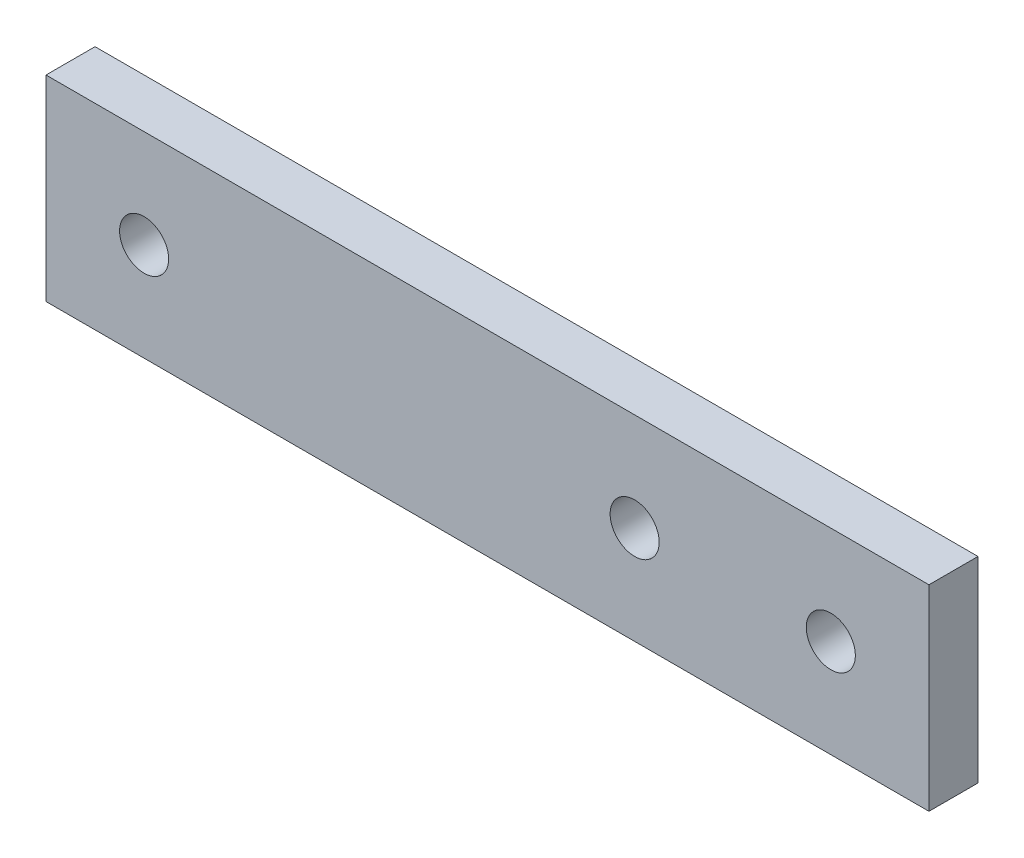
from build123d import *

# Parameters (mm, degrees)
SKETCH1_W           = 6.35
SKETCH1_H           = 25.4
BOSS_EXTRUDE1_DEPTH = 114.3
SKETCH2_R           = 3.175
CUT_EXTRUDE1_DEPTH  = 118.260276735


with BuildPart() as part:
    # Sketch1 → Boss-Extrude1 (new body)
    with BuildSketch(Plane(origin=(0, 0, 0), x_dir=(0, 0, -1), z_dir=(1, 0, 0))):
        with Locations((-3.175, 12.7)):
            Rectangle(SKETCH1_W, SKETCH1_H)
    extrude(amount=BOSS_EXTRUDE1_DEPTH)

    # Sketch2 → Cut-Extrude1 (cut, through all)
    with BuildSketch(Plane.XY.offset(6.35)):
        with Locations((12.7, 12.7)):
            Circle(SKETCH2_R)
        with Locations((76.2, 12.7)):
            Circle(SKETCH2_R)
        with Locations((101.6, 12.7)):
            Circle(SKETCH2_R)
    extrude(amount=-CUT_EXTRUDE1_DEPTH, mode=Mode.SUBTRACT)


solid = part.part
